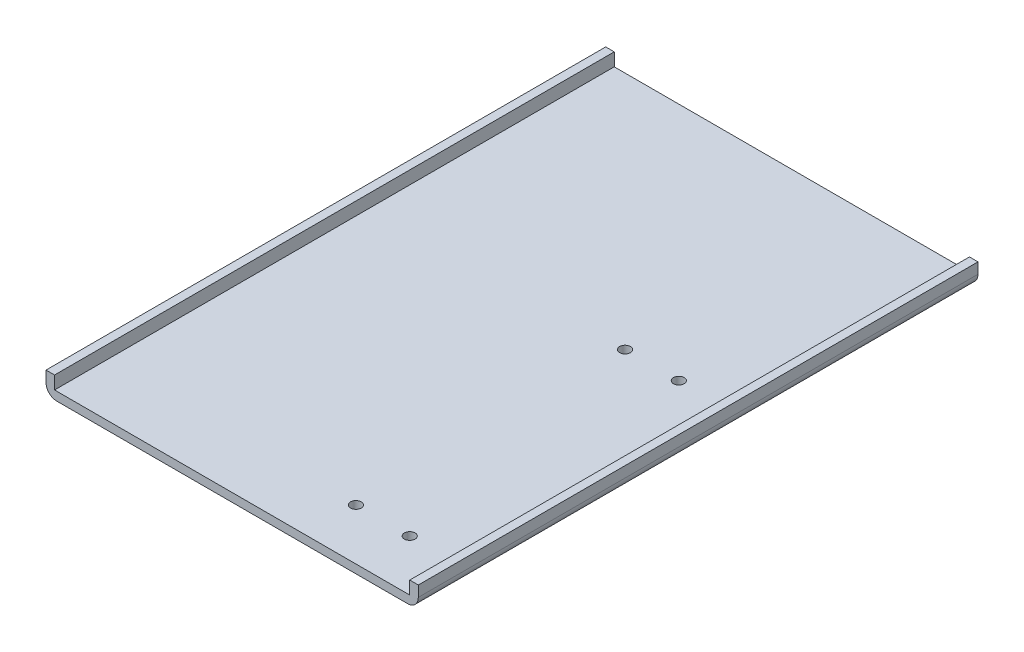
from build123d import *

# Parameters (mm, degrees)
ESQUISSE1_W             = 66
ESQUISSE1_H             = 104
BOSS_EXTRU_1_DEPTH      = 1.5875
ESQUISSE2_W             = 104
ESQUISSE2_H             = 4
BOSS_EXTRU_2_DEPTH      = 1.5875
ESQUISSE3_W             = 104
ESQUISSE3_H             = 4
BOSS_EXTRU_3_DEPTH      = 1.5875
CONG_2_R                = 2
CONG_3_R                = 2
ESQUISSE4_R             = 1
ENL_V_MAT_EXTRU_1_DEPTH = 1.5875


with BuildPart() as part:
    # Esquisse1 → Boss.-Extru.1 (new body)
    with BuildSketch(Plane(origin=(0, 0, 0), x_dir=(1, 0, 0), z_dir=(0, 1, 0))):
        Rectangle(ESQUISSE1_W, ESQUISSE1_H)
    extrude(amount=BOSS_EXTRU_1_DEPTH)

    # Esquisse2 → Boss.-Extru.2 (add)
    with BuildSketch(Plane.ZY.offset(33)):
        with Locations((0, 2)):
            Rectangle(ESQUISSE2_W, ESQUISSE2_H)
    extrude(amount=BOSS_EXTRU_2_DEPTH)

    # Esquisse3 → Boss.-Extru.3 (add)
    with BuildSketch(Plane(origin=(33, 0, 0), x_dir=(0, 0, -1), z_dir=(1, 0, 0))):
        with Locations((0, 2)):
            Rectangle(ESQUISSE3_W, ESQUISSE3_H)
    extrude(amount=BOSS_EXTRU_3_DEPTH)

    # Congé2
    cong_2_edges = [part.edges().sort_by_distance(p)[0] for p in [
        (34.5875, 0, 0),
    ]]
    fillet(cong_2_edges, radius=CONG_2_R)

    # Congé3
    cong_3_edges = [part.edges().sort_by_distance(p)[0] for p in [
        (-34.5875, 0, 0),
    ]]
    fillet(cong_3_edges, radius=CONG_3_R)

    # Esquisse4 → Enlèv. mat.-Extru.1 (cut)
    with BuildSketch(Plane(origin=(0, 1.5875, 0), x_dir=(1, 0, 0), z_dir=(0, 1, 0))):
        with Locations(Location((13.5, 7.5, 0), (0, 0, 270))):
            Circle(ESQUISSE4_R)
        with Locations(Location((23.5, 7.5, 0), (0, 0, 270))):
            Circle(ESQUISSE4_R)
        with Locations(Location((23.5, -42.5, 0), (0, 0, 270))):
            Circle(ESQUISSE4_R)
        with Locations(Location((13.5, -42.5, 0), (0, 0, 270))):
            Circle(ESQUISSE4_R)
    extrude(amount=-ENL_V_MAT_EXTRU_1_DEPTH, mode=Mode.SUBTRACT)


solid = part.part
